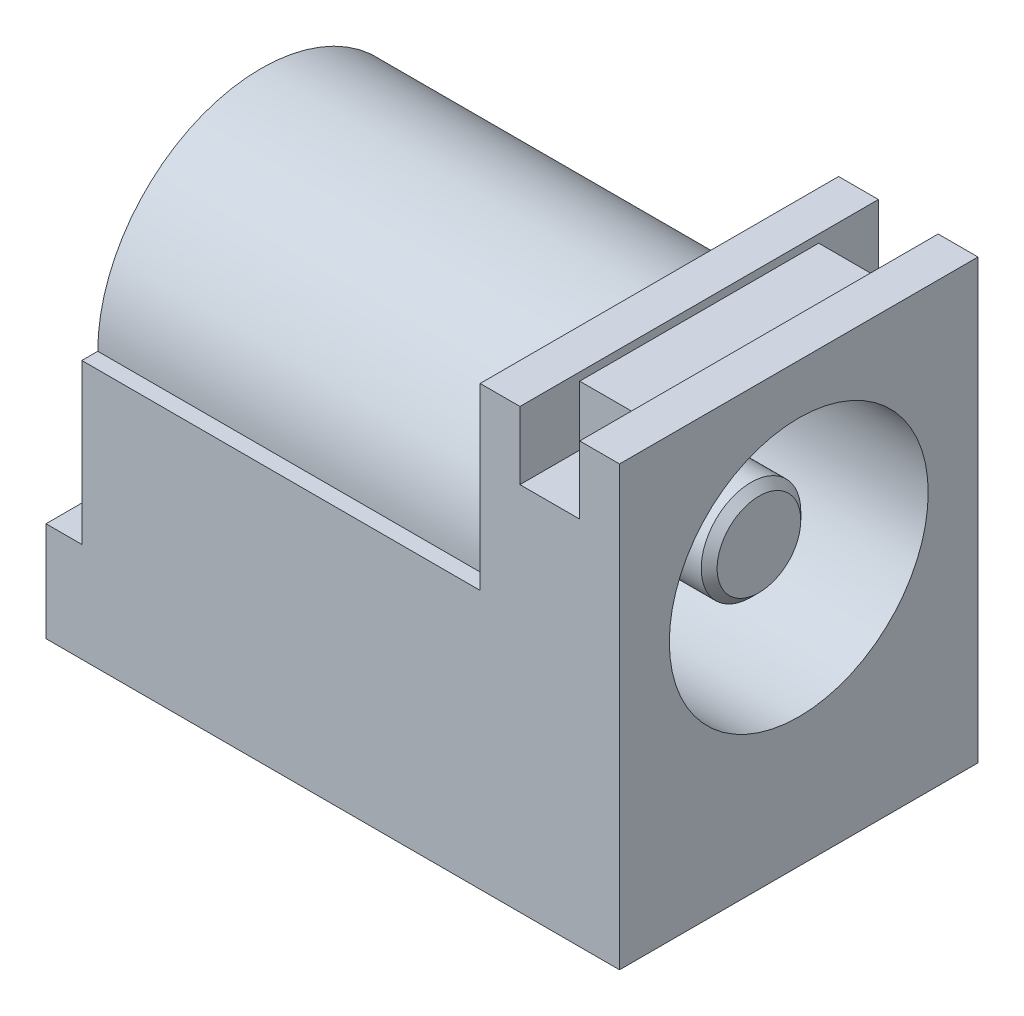
from build123d import *

# Parameters (mm, degrees)
SKETCH1_W                      = 11
SKETCH1_H                      = 9
BOSS_EXTRUDE1_DEPTH            = 2.5
BOSS_EXTRUDE2_DEPTH            = 0.4
CUT_EXTRUDE1_DEPTH             = 12.41315031
SKETCH4_W                      = 9
SKETCH4_H                      = 11
BOSS_EXTRUDE3_DEPTH            = 2.45
SKETCH5_W                      = 9
SKETCH5_H                      = 11
BOSS_EXTRUDE4_DEPTH            = 9.45
SKETCH6_W                      = 0.9
SKETCH6_H                      = 8.5
CUT_EXTRUDE2_DEPTH             = 20.892712233
SKETCH7_W                      = 0.52
SKETCH7_H                      = 6
CUT_EXTRUDE3_DEPTH             = 18.424695119
SKETCH8_W                      = 5.62
SKETCH8_H                      = 3
BOSS_EXTRUDE5_DEPTH            = 0.36
SKETCH9_W                      = 3
SKETCH9_H                      = 2.5
BOSS_EXTRUDE6_DEPTH            = 0.52
CUT_EXTRUDE4_REACH             = 19.516
SKETCH11_W                     = 1
SKETCH11_H                     = 0.1
BOSS_EXTRUDE7_DEPTH            = 0.36
CUT_EXTRUDE5_REACH             = 20.109
SKETCH14_W                     = 0.36
SKETCH14_H                     = 1
SKETCH15_W                     = 10
SKETCH15_H                     = 4.5
CUT_EXTRUDE6_DEPTH             = 20.7068516
BOSS_EXTRUDE8_DEPTH            = 10
SKETCH17_W                     = 1.5
SKETCH17_H                     = 1.7
CUT_EXTRUDE7_DEPTH             = 20.7068516
SKETCH18_W                     = 6
SKETCH18_H                     = 1.5
BOSS_EXTRUDE9_DEPTH            = 1.5
BOSS_EXTRUDE10_DEPTH           = 0.25
F_6_5_6_5_DIAMETER_HOLE1_D     = 6.5
F_6_5_6_5_DIAMETER_HOLE1_DEPTH = 7
DRAFT1_ANGLE                   = -47
DRAFT2_ANGLE                   = 47
SKETCH22_W                     = 6
SKETCH22_H                     = 1.25
CHAMFER1_SIZE                  = 0.2


with BuildPart() as part:
    # Sketch1 → Boss-Extrude1 (new body)
    with BuildSketch(Plane(origin=(-11.95, 0, 0), x_dir=(0, -1, 0), z_dir=(-1, 0, 0))):
        with Locations((1, 0)):
            Rectangle(SKETCH1_W, SKETCH1_H)
    extrude(amount=-BOSS_EXTRUDE1_DEPTH)

    # Sketch2 → Boss-Extrude2 (add)
    with BuildSketch(Plane(origin=(0, 0, -4.5), x_dir=(-1, 0, 0), z_dir=(0, 0, -1))):
        with BuildLine():
            Line((10.2, -9.5), (10.2, -7.004276533))
            Line((10.2, -7.004276533), (9.45, -6.2))
            Line((9.45, -6.2), (9.45, 4.5))
            Line((9.45, 4.5), (11.95, 4.5))
            Line((11.95, 4.5), (11.95, -6.2))
            Line((11.95, -6.2), (11.2, -7.004276533))
            Line((11.2, -7.004276533), (11.2, -9.5))
            ThreePointArc((11.2, -9.5), (10.7, -10), (10.2, -9.5))
        make_face()
    extrude(amount=BOSS_EXTRUDE2_DEPTH)

    # Sketch3 → Cut-Extrude1 (cut, through all)
    with BuildSketch(Plane(origin=(-9.45, 0, 0), x_dir=(0, 0, -1), z_dir=(1, 0, 0))):
        with BuildLine():
            Line((4.9, 4.5), (4.5, 4.5))
            Line((4.5, 4.5), (4.5, -3.5))
            ThreePointArc((4.5, -3.5), (4.787298335, -3.673670183), (4.9, -3.989897949))
            Line((4.9, -3.989897949), (4.9, 4.5))
        make_face()
    extrude(amount=-CUT_EXTRUDE1_DEPTH, mode=Mode.SUBTRACT)

    # Sketch4 → Boss-Extrude3 (add)
    with BuildSketch(Plane.ZY.offset(11.95)):
        with Locations((0, -1)):
            Rectangle(SKETCH4_W, SKETCH4_H)
    extrude(amount=BOSS_EXTRUDE3_DEPTH)

    # Sketch5 → Boss-Extrude4 (add)
    with BuildSketch(Plane(origin=(-9.45, 0, 0), x_dir=(0, 0, -1), z_dir=(1, 0, 0))):
        with Locations((0, -1)):
            Rectangle(SKETCH5_W, SKETCH5_H)
    extrude(amount=BOSS_EXTRUDE4_DEPTH)

    # Sketch6 → Cut-Extrude2 (cut, through all)
    with BuildSketch(Plane.XY.offset(4.5)):
        with Locations((-13.95, 0.25)):
            Rectangle(SKETCH6_W, SKETCH6_H)
    extrude(amount=-CUT_EXTRUDE2_DEPTH, mode=Mode.SUBTRACT)

    # Sketch7 → Cut-Extrude3 (cut, through all)
    with BuildSketch(Plane(origin=(0, -4, 0), x_dir=(-1, 0, 0), z_dir=(0, 1, 0))):
        with Locations((14.14, -1.5)):
            Rectangle(SKETCH7_W, SKETCH7_H)
    extrude(amount=-CUT_EXTRUDE3_DEPTH, mode=Mode.SUBTRACT)

    # Sketch8 → Boss-Extrude5 (add)
    with BuildSketch(Plane(origin=(-13.88, 0, 0), x_dir=(0, -1, 0), z_dir=(-1, 0, 0))):
        with Locations((1.19, 0)):
            Rectangle(SKETCH8_W, SKETCH8_H)
    extrude(amount=-BOSS_EXTRUDE5_DEPTH)

    # Sketch9 → Boss-Extrude6 (add)
    with BuildSketch(Plane.ZY.offset(13.88)):
        with Locations((-3, -5.25)):
            Rectangle(SKETCH9_W, SKETCH9_H)
    extrude(amount=BOSS_EXTRUDE6_DEPTH)

    # Sketch11 → Cut-Extrude4 (cut, up to next)
    with BuildSketch(Plane(origin=(-13.52, 0, 0), x_dir=(0, 0, -1), z_dir=(1, 0, 0)), mode=Mode.PRIVATE) as cut_extrude4_sk1:
        with Locations((1, -6.45)):
            Rectangle(SKETCH11_W, SKETCH11_H)
    cut_extrude4_tool1 = extrude(cut_extrude4_sk1.sketch, amount=-CUT_EXTRUDE4_REACH, mode=Mode.PRIVATE) & part.part
    add(cut_extrude4_tool1.solids().sort_by_distance((-13.52, -6.45, -1))[0], mode=Mode.SUBTRACT)

    # Sketch12 → Boss-Extrude7 (add)
    with BuildSketch(Plane(origin=(-13.88, 0, 0), x_dir=(0, -1, 0), z_dir=(-1, 0, 0))):
        with BuildLine():
            Line((9.5, 0.5), (6.5, 0.5))
            Line((6.5, 0.5), (6.5, -0.5))
            Line((6.5, -0.5), (9.5, -0.5))
            ThreePointArc((9.5, -0.5), (10, 0), (9.5, 0.5))
        make_face()
    extrude(amount=-BOSS_EXTRUDE7_DEPTH)

    # Sketch14 → Cut-Extrude5 (cut, up to next)
    with BuildSketch(Plane(origin=(0, -5.32763129, 0), x_dir=(1, 0, 0), z_dir=(0, 1, 0)), mode=Mode.PRIVATE) as cut_extrude5_sk1:
        with Locations((-13.7, -1)):
            Rectangle(SKETCH14_W, SKETCH14_H)
    cut_extrude5_tool1 = extrude(cut_extrude5_sk1.sketch, amount=-CUT_EXTRUDE5_REACH, mode=Mode.PRIVATE) & part.part
    add(cut_extrude5_tool1.solids().sort_by_distance((-13.7, -5.327631, 1))[0], mode=Mode.SUBTRACT)

    # Sketch15 → Cut-Extrude6 (cut, through all)
    with BuildSketch(Plane(origin=(0, 0, -4.5), x_dir=(-1, 0, 0), z_dir=(0, 0, -1))):
        with Locations((8.5, 2.25)):
            Rectangle(SKETCH15_W, SKETCH15_H)
    extrude(amount=-CUT_EXTRUDE6_DEPTH, mode=Mode.SUBTRACT)

    # Sketch16 → Boss-Extrude8 (add)
    with BuildSketch(Plane.ZY.offset(3.5)):
        with BuildLine():
            Line((4.1, 0), (-4.1, 0))
            ThreePointArc((-4.1, 0), (0, 4.1), (4.1, 0))
        make_face()
    extrude(amount=BOSS_EXTRUDE8_DEPTH)

    # Sketch17 → Cut-Extrude7 (cut, through all)
    with BuildSketch(Plane(origin=(0, 0, -4.5), x_dir=(-1, 0, 0), z_dir=(0, 0, -1))):
        with Locations((1.75, 3.65)):
            Rectangle(SKETCH17_W, SKETCH17_H)
    extrude(amount=-CUT_EXTRUDE7_DEPTH, mode=Mode.SUBTRACT)

    # Sketch18 → Boss-Extrude9 (add)
    with BuildSketch(Plane(origin=(-2.5, 0, 0), x_dir=(0, 0, -1), z_dir=(1, 0, 0))):
        with Locations((0, 3.55)):
            Rectangle(SKETCH18_W, SKETCH18_H)
    extrude(amount=BOSS_EXTRUDE9_DEPTH)

    # Sketch19 → Boss-Extrude10 (add)
    with BuildSketch(Plane(origin=(-7.825, 0, 0), x_dir=(0, -1, 0), z_dir=(-1, 0, 0))):
        with BuildLine():
            Line((9.5, 0.5), (6.5, 0.5))
            Line((6.5, 0.5), (6.5, -0.5))
            Line((6.5, -0.5), (9.5, -0.5))
            ThreePointArc((9.5, -0.5), (10, 0), (9.5, 0.5))
        make_face()
    extrude(amount=-BOSS_EXTRUDE10_DEPTH)

    # Ø6.5 (6.5) Diameter Hole1
    with Locations(Plane(origin=(0, 0, 0), x_dir=(0, 0, -1), z_dir=(1, 0, 0))):
        with Locations((0, 0)):
            Hole(F_6_5_6_5_DIAMETER_HOLE1_D / 2, depth=F_6_5_6_5_DIAMETER_HOLE1_DEPTH)

    # Draft1
    draft1_faces = [part.faces().sort_by_distance(p)[0] for p in [
        (-13.7, -5.32763129, 1),
    ]]
    draft(draft1_faces, Plane(origin=(-14.4, -10, 1.5), x_dir=(-1, 0, 0), z_dir=(0, 0, -1)), DRAFT1_ANGLE)

    # Draft2
    draft2_faces = [part.faces().sort_by_distance(p)[0] for p in [
        (-13.7, -6.4, -1),
    ]]
    draft(draft2_faces, Plane(origin=(-14.884987562, -6.4, -0.5), x_dir=(-1, 0, 0), z_dir=(0, 0, -1)), DRAFT2_ANGLE)

    # Sketch22 → Revolve1 (revolve)
    with BuildSketch(Plane.XY, mode=Mode.PRIVATE) as revolve1_sk:
        with Locations((-4, 0.625)):
            Rectangle(SKETCH22_W, SKETCH22_H)
    revolve(revolve1_sk.sketch.rotate(Axis((-7, 0, 0), (1, 0, 0)), 270), axis=Axis((-7, 0, 0), (1, 0, 0)))

    # Chamfer1
    chamfer1_edges = [part.edges().sort_by_distance(p)[0] for p in [
        (-1, 0, 1.25),
    ]]
    chamfer(chamfer1_edges, length=CHAMFER1_SIZE)


solid = part.part
